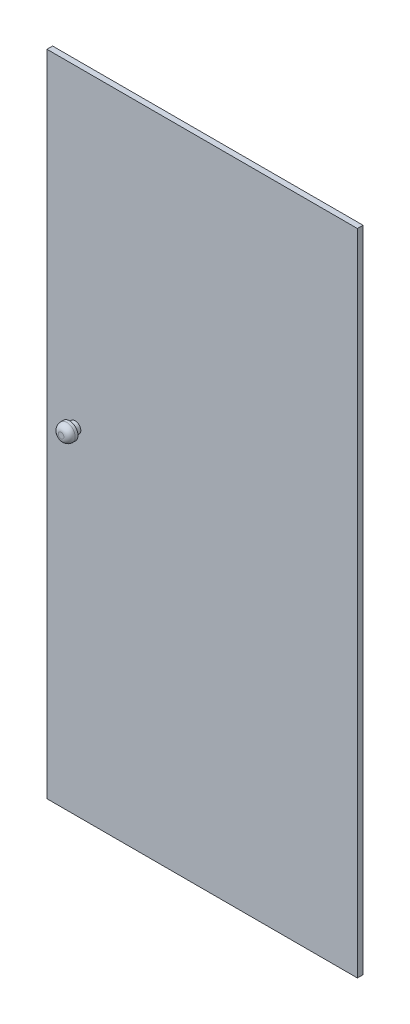
from build123d import *

# Parameters (mm, degrees)
SKETCH1_W           = 550
SKETCH1_H           = 1150
BOSS_EXTRUDE1_DEPTH = 10
SKETCH2_R           = 10
BOSS_EXTRUDE2_DEPTH = 10
SKETCH3_R           = 15
BOSS_EXTRUDE3_DEPTH = 15
FILLET4_R           = 10


with BuildPart() as part:
    # Sketch1 → Boss-Extrude1 (new body)
    with BuildSketch(Plane.XY):
        Rectangle(SKETCH1_W, SKETCH1_H)
    extrude(amount=BOSS_EXTRUDE1_DEPTH)

    # Sketch2 → Boss-Extrude2 (add)
    with BuildSketch(Plane.XY.offset(10)):
        with Locations((-225, 20)):
            Circle(SKETCH2_R)
    extrude(amount=BOSS_EXTRUDE2_DEPTH)

    # Sketch3 → Boss-Extrude3 (add)
    with BuildSketch(Plane.XY.offset(20)):
        with Locations((-225, 20)):
            Circle(SKETCH3_R)
    extrude(amount=BOSS_EXTRUDE3_DEPTH)

    # Fillet4
    fillet4_edges = [part.edges().sort_by_distance(p)[0] for p in [
        (-240, 20, 35),
    ]]
    fillet(fillet4_edges, radius=FILLET4_R)


solid = part.part
